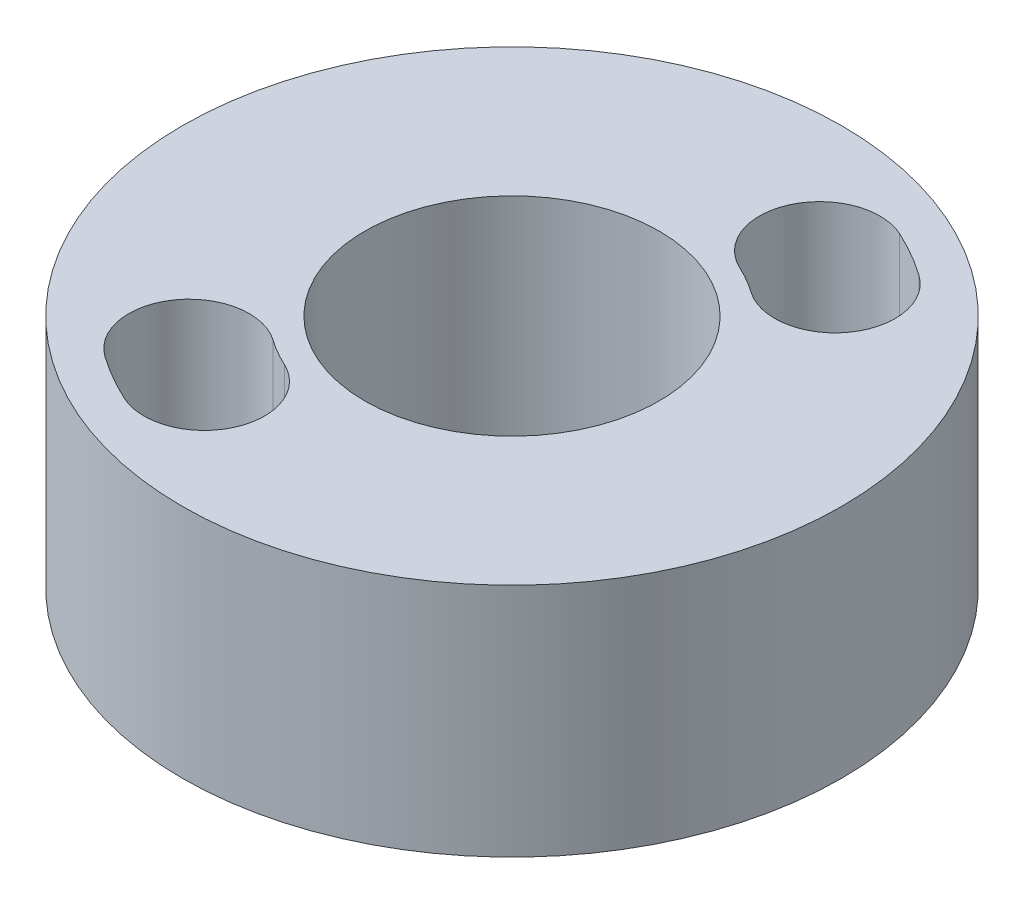
from build123d import *

# Parameters (mm, degrees)
SKETCH1_R           = 17.78
SKETCH1_R_2         = 7.9375
BOSS_EXTRUDE1_DEPTH = 12.7
CUT_EXTRUDE1_DEPTH  = 29.169962726
CIRPATTERN1_COUNT   = 2


with BuildPart() as part:
    # Sketch1 → Boss-Extrude1 (new body)
    with BuildSketch(Plane(origin=(0, 0, 0), x_dir=(1, 0, 0), z_dir=(0, 1, 0))):
        with Locations(Location((0, 0, 0), (0, 0, 270))):
            Circle(SKETCH1_R)
        with Locations(Location((0, 0, 0), (0, 0, 270))):
            Circle(SKETCH1_R_2, mode=Mode.SUBTRACT)
    extrude(amount=BOSS_EXTRUDE1_DEPTH)

    # Sketch2 → Cut-Extrude1 (cut, through all)
    with BuildSketch(Plane(origin=(0, 12.7, 0), x_dir=(1, 0, 0), z_dir=(0, 1, 0))):
        with BuildLine():
            ThreePointArc((6.615, 14.293504644), (7.875, 13.63990011), (9.071038131, 12.875510368))
            ThreePointArc((9.071038131, 12.875510368), (9.856087957, 8.346857503), (5.327435093, 7.561807676))
            ThreePointArc((5.327435093, 7.561807676), (4.625, 8.010734985), (3.885, 8.394597965))
            ThreePointArc((3.885, 8.394597965), (2.300546661, 12.709051305), (6.615, 14.293504644))
        make_face()
    cut_extrude1 = extrude(amount=-CUT_EXTRUDE1_DEPTH, mode=Mode.SUBTRACT)

    # CirPattern1: Cut-Extrude1 ×2 about axis
    cirpattern1_axis = Axis((0, 0, 0), (0, 1, 0))
    for i in range(1, CIRPATTERN1_COUNT):
        add(cut_extrude1.rotate(cirpattern1_axis, i * 360 / CIRPATTERN1_COUNT), mode=Mode.SUBTRACT)


solid = part.part
